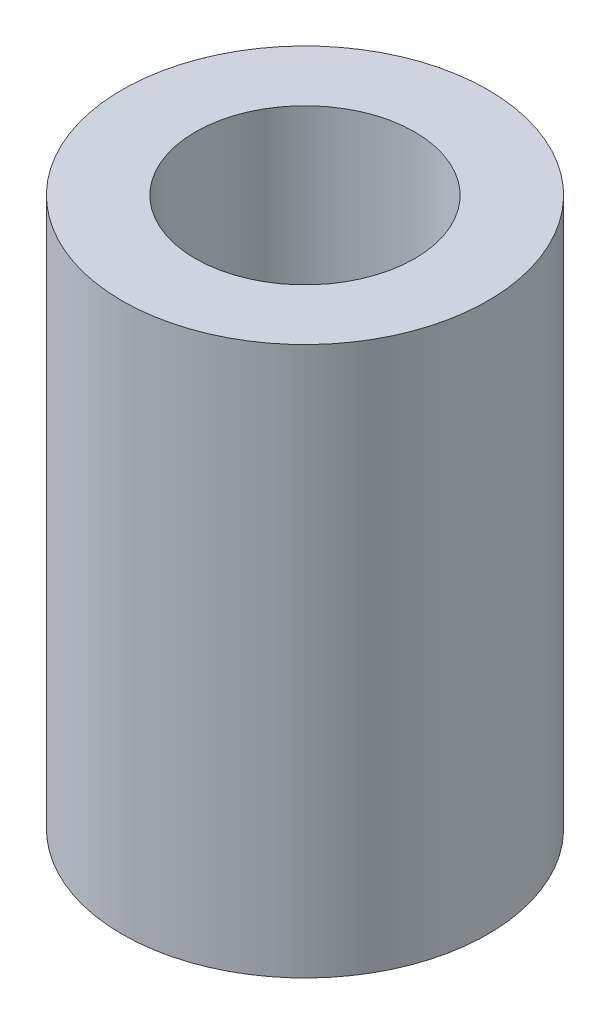
from build123d import *

# Parameters (mm, degrees)
SKETCH_1_R      = 10
SKETCH_1_R_2    = 6
EXTRUDE_1_DEPTH = 30


with BuildPart() as part:
    # Эскиз1 → Бобышка-Вытянуть1 (new body)
    with BuildSketch(Plane(origin=(0, 0, 0), x_dir=(1, 0, 0), z_dir=(0, 1, 0))):
        with Locations(Location((-10, -10, 0), (0, 0, 270))):
            Circle(SKETCH_1_R)
        with Locations(Location((-10, -10, 0), (0, 0, 270))):
            Circle(SKETCH_1_R_2, mode=Mode.SUBTRACT)
    extrude(amount=EXTRUDE_1_DEPTH)


solid = part.part
